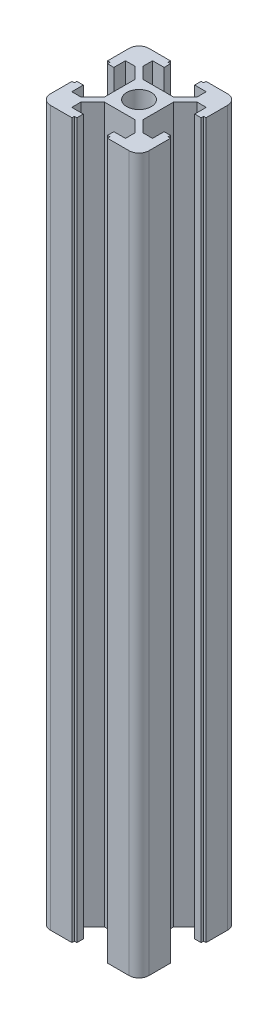
from build123d import *

# Parameters (mm, degrees)
SKETCH_1_R      = 2.5
EXTRUDE_1_DEPTH = 145


with BuildPart() as part:
    # 草图1 → 凸台-拉伸1 (new body)
    with BuildSketch(Plane(origin=(0, 0, 0), x_dir=(1, 0, 0), z_dir=(0, 1, 0))):
        with BuildLine():
            Line((-3.948528137, -3.1), (-6.298528137, -5.45))
            Line((-6.298528137, -5.45), (-8.2, -5.45))
            Line((-8.2, -5.45), (-8.2, -3.1))
            Line((-8.2, -3.1), (-9.5, -3.1))
            Line((-9.5, -3.1), (-9.5, -3.6))
            Line((-9.5, -3.6), (-10, -3.6))
            Line((-10, -3.6), (-10, -8))
            ThreePointArc((-10, -8), (-9.414213562, -9.414213562), (-8, -10))
            Line((-8, -10), (-3.6, -10))
            Line((-3.6, -10), (-3.6, -9.5))
            Line((-3.6, -9.5), (-3.1, -9.5))
            Line((-3.1, -9.5), (-3.1, -8.2))
            Line((-3.1, -8.2), (-5.45, -8.2))
            Line((-5.45, -8.2), (-5.45, -6.298528137))
            Line((-5.45, -6.298528137), (-3.1, -3.948528137))
            Line((-3.1, -3.948528137), (0, -3.948528137))
            Line((0, -3.948528137), (3.1, -3.948528137))
            Line((3.1, -3.948528137), (5.45, -6.298528137))
            Line((5.45, -6.298528137), (5.45, -8.2))
            Line((5.45, -8.2), (3.1, -8.2))
            Line((3.1, -8.2), (3.1, -9.5))
            Line((3.1, -9.5), (3.6, -9.5))
            Line((3.6, -9.5), (3.6, -10))
            Line((3.6, -10), (8, -10))
            ThreePointArc((8, -10), (9.414213562, -9.414213562), (10, -8))
            Line((10, -8), (10, -3.6))
            Line((10, -3.6), (9.5, -3.6))
            Line((9.5, -3.6), (9.5, -3.1))
            Line((9.5, -3.1), (8.2, -3.1))
            Line((8.2, -3.1), (8.2, -5.45))
            Line((8.2, -5.45), (6.298528137, -5.45))
            Line((6.298528137, -5.45), (3.948528137, -3.1))
            Line((3.948528137, -3.1), (3.948528137, 0))
            Line((3.948528137, 0), (3.948528137, 3.1))
            Line((3.948528137, 3.1), (6.298528137, 5.45))
            Line((6.298528137, 5.45), (8.2, 5.45))
            Line((8.2, 5.45), (8.2, 3.1))
            Line((8.2, 3.1), (9.5, 3.1))
            Line((9.5, 3.1), (9.5, 3.6))
            Line((9.5, 3.6), (10, 3.6))
            Line((10, 3.6), (10, 8))
            ThreePointArc((10, 8), (9.414213562, 9.414213562), (8, 10))
            Line((8, 10), (3.6, 10))
            Line((3.6, 10), (3.6, 9.5))
            Line((3.6, 9.5), (3.1, 9.5))
            Line((3.1, 9.5), (3.1, 8.2))
            Line((3.1, 8.2), (5.45, 8.2))
            Line((5.45, 8.2), (5.45, 6.298528137))
            Line((5.45, 6.298528137), (3.1, 3.948528137))
            Line((3.1, 3.948528137), (0, 3.948528137))
            Line((0, 3.948528137), (-3.1, 3.948528137))
            Line((-3.1, 3.948528137), (-5.45, 6.298528137))
            Line((-5.45, 6.298528137), (-5.45, 8.2))
            Line((-5.45, 8.2), (-3.1, 8.2))
            Line((-3.1, 8.2), (-3.1, 9.5))
            Line((-3.1, 9.5), (-3.6, 9.5))
            Line((-3.6, 9.5), (-3.6, 10))
            Line((-3.6, 10), (-8, 10))
            ThreePointArc((-8, 10), (-9.414213562, 9.414213562), (-10, 8))
            Line((-10, 8), (-10, 3.6))
            Line((-10, 3.6), (-9.5, 3.6))
            Line((-9.5, 3.6), (-9.5, 3.1))
            Line((-9.5, 3.1), (-8.2, 3.1))
            Line((-8.2, 3.1), (-8.2, 5.45))
            Line((-8.2, 5.45), (-6.298528137, 5.45))
            Line((-6.298528137, 5.45), (-3.948528137, 3.1))
            Line((-3.948528137, 3.1), (-3.948528137, 0))
            Line((-3.948528137, 0), (-3.948528137, -3.1))
        make_face()
        with Locations(Location((0, 0, 0), (0, 0, 270))):
            Circle(SKETCH_1_R, mode=Mode.SUBTRACT)
    extrude(amount=EXTRUDE_1_DEPTH)


solid = part.part
